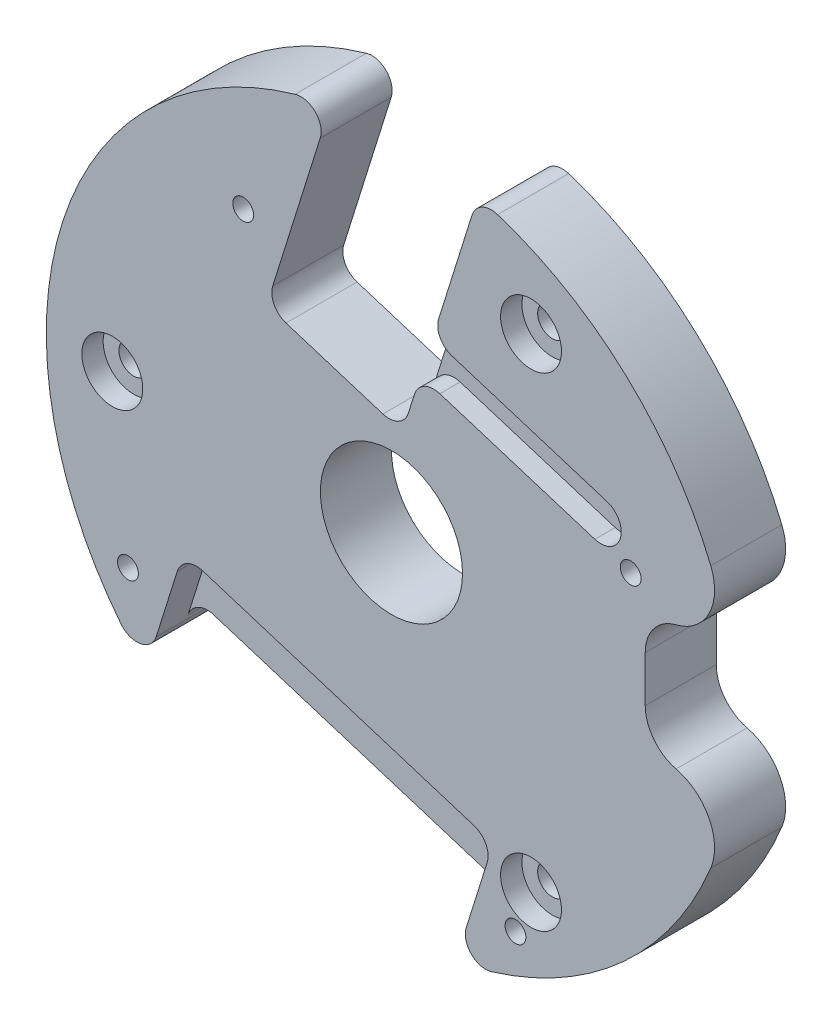
from build123d import *

# Parameters (mm, degrees)
BOSS_EXTRUDE1_DEPTH                        = 4
BOSS_EXTRUDE1_DEPTH_BACK                   = 3
SKETCH1_R                                  = 34
SKETCH1_R_2                                = 1
SKETCH1_R_3                                = 7
CUT_EXTRUDE1_REACH                         = 50.59
CUT_EXTRUDE2_REACH                         = 50.744
FILLET1_R                                  = 5
FILLET2_R                                  = 4
M2_5X0_45_TAPPED_HOLE1_D                   = 2.05
CBORE_FOR_M2_5_PAN_HEAD_SCREW1_D           = 2.9
CBORE_FOR_M2_5_PAN_HEAD_SCREW1_DEPTH       = 7
CBORE_FOR_M2_5_PAN_HEAD_SCREW1_CBORE_D     = 6
CBORE_FOR_M2_5_PAN_HEAD_SCREW1_CBORE_DEPTH = 2.1
SKETCH13_R                                 = 2.2
CUT_EXTRUDE3_DEPTH                         = 3
CUT_EXTRUDE4_REACH                         = 50.59
FILLET3_R                                  = 2
CUT_EXTRUDE5_DEPTH                         = 3
FILLET4_R                                  = 2
CUT_EXTRUDE7_DEPTH                         = 2
FILLET5_R                                  = 2


with BuildPart() as part:
    # Sketch1 → Boss-Extrude1 (new, two sides: drawn at the far end of the back side and taken through both)
    with BuildSketch(Plane.XY.offset(-BOSS_EXTRUDE1_DEPTH_BACK)):
        Circle(SKETCH1_R)
        with Locations((-27.5, 0)):
            Circle(SKETCH1_R_2, mode=Mode.SUBTRACT)
        with Locations((13.75, 23.815698604)):
            Circle(SKETCH1_R_2, mode=Mode.SUBTRACT)
        with Locations((13.75, -23.815698604)):
            Circle(SKETCH1_R_2, mode=Mode.SUBTRACT)
        Circle(SKETCH1_R_3, mode=Mode.SUBTRACT)
    extrude(amount=BOSS_EXTRUDE1_DEPTH + BOSS_EXTRUDE1_DEPTH_BACK)

    # Sketch2 → Cut-Extrude1 (cut, up to next)
    with BuildSketch(Plane.XY.offset(4), mode=Mode.PRIVATE) as cut_extrude1_sk1:
        with BuildLine():
            Line((33.466401061, 6), (25, 6))
            Line((25, 6), (25, -6))
            Line((25, -6), (33.466401061, -6))
            ThreePointArc((33.466401061, -6), (34, 0), (33.466401061, 6))
        make_face()
    cut_extrude1_tool1 = extrude(cut_extrude1_sk1.sketch, amount=-CUT_EXTRUDE1_REACH, mode=Mode.PRIVATE) & part.part
    add(cut_extrude1_tool1.solids().sort_by_distance((29.412779, 0, 4))[0], mode=Mode.SUBTRACT)

    # Sketch4 → Cut-Extrude2 (cut, up to next)
    with BuildSketch(Plane.XY.offset(-4), mode=Mode.PRIVATE) as cut_extrude2_sk1:
        with BuildLine():
            Line((-24.229587732, -23.852192317), (-22.452552523, -18.173755396))
            Line((-22.452552523, -18.173755396), (8.086940161, -27.730919545))
            Line((8.086940161, -27.730919545), (6.309904952, -33.409356466))
            ThreePointArc((6.309904952, -33.409356466), (-10.154486908, -32.448210977), (-24.229587732, -23.852192317))
        make_face()
    cut_extrude2_tool1 = extrude(cut_extrude2_sk1.sketch, amount=CUT_EXTRUDE2_REACH, mode=Mode.PRIVATE) & part.part
    add(cut_extrude2_tool1.solids().sort_by_distance((-8.498569, -27.1568, -4))[0], mode=Mode.SUBTRACT)

    # Fillet1
    fillet1_edges = [part.edges().sort_by_distance(p)[0] for p in [
        (33.466401061, 6, 0.5),
        (33.466401061, -6, 0.5),
    ]]
    fillet(fillet1_edges, radius=FILLET1_R)

    # Fillet2
    fillet2_edges = [part.edges().sort_by_distance(p)[0] for p in [
        (25, -6, 0.5),
        (25, 6, 0.5),
    ]]
    fillet(fillet2_edges, radius=FILLET2_R)

    # M2.5x0.45 Tapped Hole1 (through all)
    with Locations(Plane.XY.offset(4)):
        with Locations((-25.95639466, -15.977032774), (12.217971196, -27.92348796), (23.567103623, 8.342159603), (-14.607262233, 20.288614789)):
            Hole(M2_5X0_45_TAPPED_HOLE1_D / 2)

    # CBORE for M2.5 Pan Head Screw1
    with Locations(Plane.XY.offset(4)):
        with Locations((-27.5, 0), (13.75, 23.815698604), (13.75, -23.815698604)):
            CounterBoreHole(CBORE_FOR_M2_5_PAN_HEAD_SCREW1_D / 2, CBORE_FOR_M2_5_PAN_HEAD_SCREW1_CBORE_D / 2, CBORE_FOR_M2_5_PAN_HEAD_SCREW1_CBORE_DEPTH, depth=CBORE_FOR_M2_5_PAN_HEAD_SCREW1_DEPTH)

    # Sketch13 → Cut-Extrude3 (cut)
    with BuildSketch(Plane(origin=(0, 0, -3), x_dir=(-1, 0, 0), z_dir=(0, 0, -1))):
        with Locations((-13.75, 23.815698604)):
            Circle(SKETCH13_R)
        with Locations((27.5, 0)):
            Circle(SKETCH13_R)
        with Locations((-13.75, -23.815698604)):
            Circle(SKETCH13_R)
    extrude(amount=-CUT_EXTRUDE3_DEPTH, mode=Mode.SUBTRACT)

    # Sketch14 → Cut-Extrude4 (cut, up to next)
    with BuildSketch(Plane.XY.offset(4), mode=Mode.PRIVATE) as cut_extrude4_sk1:
        with BuildLine():
            Line((-5.976383774, 33.47062648), (-12.295486181, 13.278215978))
            Line((-12.295486181, 13.278215978), (1.065541868, 9.096956663))
            Line((1.065541868, 9.096956663), (8.519375308, 32.915349677))
            ThreePointArc((8.519375308, 32.915349677), (1.301454789, 33.975082273), (-5.976383774, 33.47062648))
        make_face()
    cut_extrude4_tool1 = extrude(cut_extrude4_sk1.sketch, amount=-CUT_EXTRUDE4_REACH, mode=Mode.PRIVATE) & part.part
    add(cut_extrude4_tool1.solids().sort_by_distance((-1.905533, 22.418355, 4))[0], mode=Mode.SUBTRACT)

    # Fillet3
    fillet3_edges = [part.edges().sort_by_distance(p)[0] for p in [
        (-5.976383774, 33.47062648, 0.5),
        (8.519375308, 32.915349677, 0.5),
        (1.065541868, 9.096956663, 0.5),
        (-12.295486181, 13.278215978, 0.5),
        (-24.229587732, -23.852192317, 0.5),
        (6.309904952, -33.409356466, 0.5),
        (8.086940161, -27.730919545, 0.5),
        (-22.452552523, -18.173755396, 0.5),
    ]]
    fillet(fillet3_edges, radius=FILLET3_R)

    # Sketch15 → Cut-Extrude5 (cut)
    with BuildSketch(Plane.XY.offset(4)):
        Polygon((6.448401058, -32.966798325), (10.028239129, -21.527585094), (-20.511253555, -11.970420945), (-24.091091627, -23.409634176), align=None)
    extrude(amount=-CUT_EXTRUDE5_DEPTH, mode=Mode.SUBTRACT)

    # Fillet4
    fillet4_edges = [part.edges().sort_by_distance(p)[0] for p in [
        (10.028239129, -21.527585094, 2.5),
        (-20.511253555, -11.970420945, 2.5),
    ]]
    fillet(fillet4_edges, radius=FILLET4_R)

    # Sketch16 → Cut-Extrude7 (cut)
    with BuildSketch(Plane.XY.offset(4)):
        with BuildLine():
            Line((20.035974781, 9.447206707), (2.857510146, 14.823111541))
            Line((2.857510146, 14.823111541), (4.052155665, 18.640548127))
            Line((4.052155665, 18.640548127), (21.2306203, 13.264643293))
            ThreePointArc((21.2306203, 13.264643293), (22.542015833, 10.758602241), (20.035974781, 9.447206707))
        make_face()
    extrude(amount=-CUT_EXTRUDE7_DEPTH, mode=Mode.SUBTRACT)

    # Fillet5
    fillet5_edges = [part.edges().sort_by_distance(p)[0] for p in [
        (2.857510146, 14.823111541, 3),
        (4.052155665, 18.640548127, 3),
    ]]
    fillet(fillet5_edges, radius=FILLET5_R)


solid = part.part
